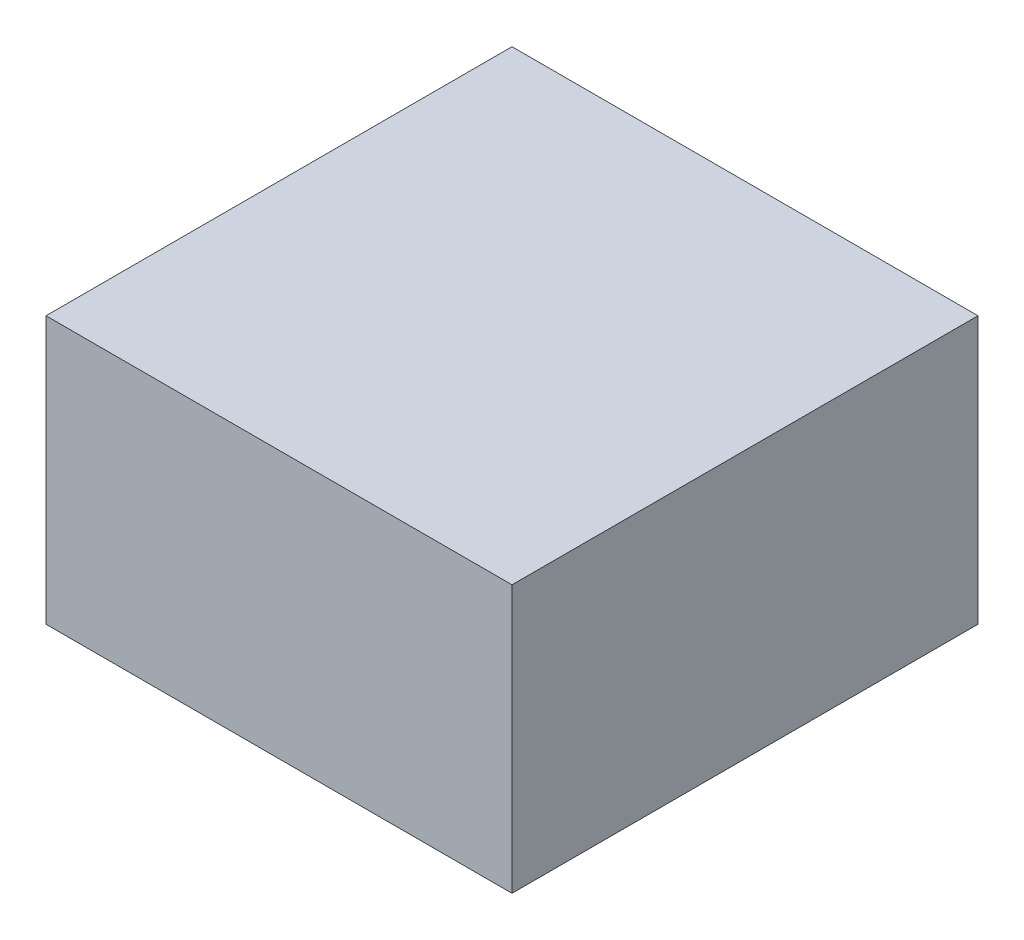
from build123d import *

# Parameters (mm, degrees)
SKETCH1_W           = 150
SKETCH1_H           = 86
BOSS_EXTRUDE1_DEPTH = 150


with BuildPart() as part:
    # Sketch1 → Boss-Extrude1 (new body)
    with BuildSketch(Plane.XY):
        with Locations((75, 43)):
            Rectangle(SKETCH1_W, SKETCH1_H)
    extrude(amount=BOSS_EXTRUDE1_DEPTH)


solid = part.part
